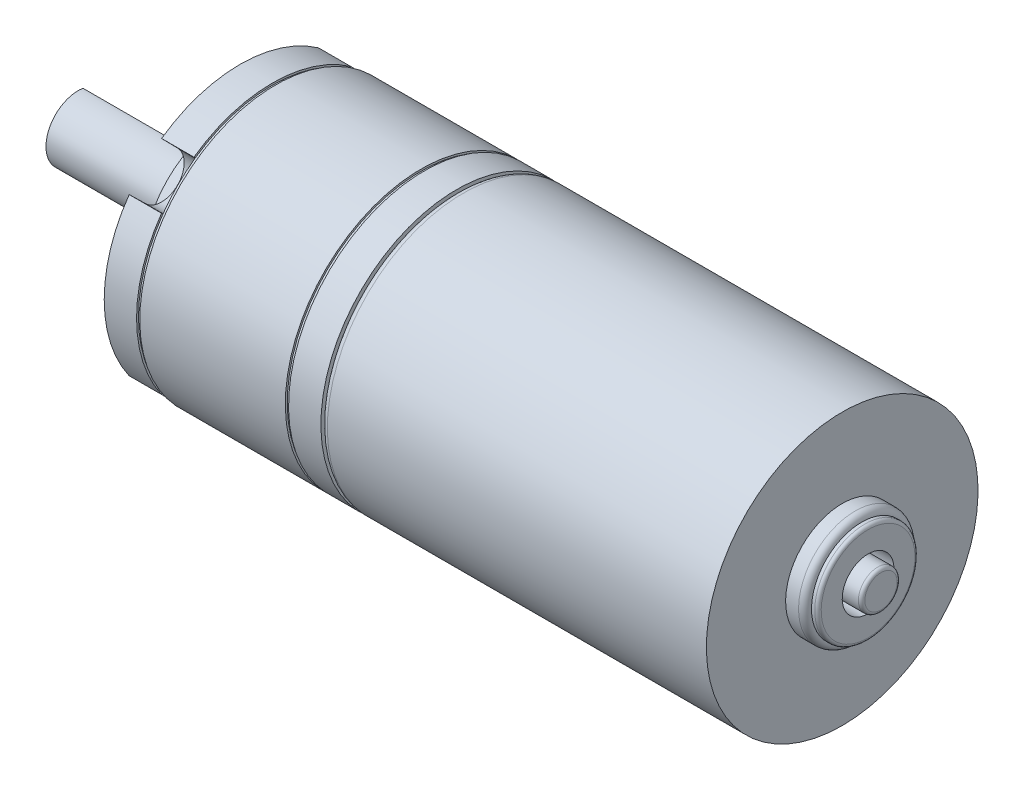
from build123d import *

# Parameters (mm, degrees)
SKETCH1_W               = 0.5
SKETCH1_H               = 20.7
SKETCH1_W_2             = 23
SKETCH1_H_2             = 5
SKETCH2_R               = 2.1
CUT_EXTRUDE1_DEPTH      = 10
CUT_EXTRUDE2_DEPTH      = 16
CUT_EXTRUDE3_DEPTH      = 5
SKETCH14_R              = 2.25
CUT_EXTRUDE4_DEPTH      = 10
ENL_V_START             = -4
ESQUISSE4_R             = 4
ESQUISSE4_R_2           = 3
ENL_V_MAT_EXTRU_1_DEPTH = 4


with BuildPart() as part:
    # Sketch1 → Revolve3 (revolve)
    with BuildSketch(Plane.XY, mode=Mode.PRIVATE) as revolve3_sk:
        with BuildLine():
            Line((0, 20), (0, 0))
            Line((0, 0), (59.6, 0))
            Line((59.6, 0), (59.6, 8.75))
            Line((59.6, 8.75), (59.6, 21))
            Line((59.6, 21), (1, 21))
            ThreePointArc((1, 21), (0.292893219, 20.707106781), (0, 20))
        make_face()
        Polygon((-5, 0), (0, 0), (0, 20), (0, 21), (-5, 21), (-5, 20.7), align=None)
        with BuildLine():
            Line((59.6, 8.75), (59.6, 0))
            Line((59.6, 0), (62.6, 0))
            Line((62.6, 0), (62.6, 7.75))
            ThreePointArc((62.6, 7.75), (62.307106781, 8.457106781), (61.6, 8.75))
            Line((61.6, 8.75), (59.6, 8.75))
        make_face()
        with Locations((-5.25, 10.35)):
            Rectangle(SKETCH1_W, SKETCH1_H)
        with BuildLine():
            Line((62.6, 7.75), (62.6, 0))
            Line((62.6, 0), (63.6, 0))
            Line((63.6, 0), (63.6, 3))
            Line((63.6, 3), (63.6, 7.25))
            ThreePointArc((63.6, 7.25), (63.453553391, 7.603553391), (63.1, 7.75))
            Line((63.1, 7.75), (62.6, 7.75))
        make_face()
        Polygon((-28, 0), (-5.5, 0), (-5.5, 20.7), (-5.5, 21), (-28, 21), (-28, 20.7), align=None)
        with BuildLine():
            Line((63.6, 3), (63.6, 0))
            Line((63.6, 0), (65.6, 0))
            Line((65.6, 0), (65.6, 2.5))
            ThreePointArc((65.6, 2.5), (65.453553391, 2.853553391), (65.1, 3))
            Line((65.1, 3), (63.6, 3))
        make_face()
        with Locations((-28.25, 10.35)):
            Rectangle(SKETCH1_W, SKETCH1_H)
        Polygon((-33.5, 0), (-28.5, 0), (-28.5, 20.7), (-28.5, 21), (-33.5, 21), (-33.5, 13), align=None)
        Polygon((-35.5, 0), (-33.5, 0), (-33.5, 13), (-35.5, 13), (-35.5, 5), align=None)
        with Locations((-47, 2.5)):
            Rectangle(SKETCH1_W_2, SKETCH1_H_2)
    revolve(revolve3_sk.sketch.rotate(Axis((-106.294937031, 0, 0), (1, 0, 0)), 180), axis=Axis((-106.294937031, 0, 0), (1, 0, 0)))

    # Sketch2 → Cut-Extrude1 (cut)
    with BuildSketch(Plane.ZY.offset(33.5)):
        with Locations(Location((0, 17.5, 0), (0, 0, 270))):
            Circle(SKETCH2_R)
        with Locations(Location((17.5, 0, 0), (0, 0, 270))):
            Circle(SKETCH2_R)
        with Locations(Location((0, -17.5, 0), (0, 0, 270))):
            Circle(SKETCH2_R)
        with Locations(Location((-17.5, 0, 0), (0, 0, 270))):
            Circle(SKETCH2_R)
    extrude(amount=-CUT_EXTRUDE1_DEPTH, mode=Mode.SUBTRACT)

    # Sketch5 → Cut-Extrude2 (cut)
    with BuildSketch(Plane.ZY.offset(58.5)):
        Polygon((-4.949747468, 0.707106781), (-0.707106781, 4.949747468), (-1.414213562, 5.656854249), (-5.656854249, 1.414213562), align=None)
    extrude(amount=-CUT_EXTRUDE2_DEPTH, mode=Mode.SUBTRACT)

    # Sketch12 → Cut-Extrude3 (cut)
    with BuildSketch(Plane.ZY.offset(33.5)):
        with BuildLine():
            Line((9.629672349, 14.579093037), (12.132820594, 17.140439447))
            ThreePointArc((12.132820594, 17.140439447), (14.849242405, 14.849242405), (17.140439447, 12.132820594))
            Line((17.140439447, 12.132820594), (14.579093037, 9.629672349))
            ThreePointArc((14.579093037, 9.629672349), (9.65794686, 9.65794686), (9.629672349, 14.579093037))
        make_face()
        with BuildLine():
            Line((14.579093037, -9.629672349), (17.140439447, -12.132820594))
            ThreePointArc((17.140439447, -12.132820594), (14.849242405, -14.849242405), (12.132820594, -17.140439447))
            Line((12.132820594, -17.140439447), (9.629672349, -14.579093037))
            ThreePointArc((9.629672349, -14.579093037), (9.65794686, -9.65794686), (14.579093037, -9.629672349))
        make_face()
        with BuildLine():
            Line((-9.629672349, -14.579093037), (-12.132820594, -17.140439447))
            ThreePointArc((-12.132820594, -17.140439447), (-14.849242405, -14.849242405), (-17.140439447, -12.132820594))
            Line((-17.140439447, -12.132820594), (-14.579093037, -9.629672349))
            ThreePointArc((-14.579093037, -9.629672349), (-9.65794686, -9.65794686), (-9.629672349, -14.579093037))
        make_face()
        with BuildLine():
            Line((-14.579093037, 9.629672349), (-17.140439447, 12.132820594))
            ThreePointArc((-17.140439447, 12.132820594), (-14.849242405, 14.849242405), (-12.132820594, 17.140439447))
            Line((-12.132820594, 17.140439447), (-9.629672349, 14.579093037))
            ThreePointArc((-9.629672349, 14.579093037), (-9.65794686, 9.65794686), (-14.579093037, 9.629672349))
        make_face()
    extrude(amount=-CUT_EXTRUDE3_DEPTH, mode=Mode.SUBTRACT)

    # Sketch14 → Cut-Extrude4 (cut)
    with BuildSketch(Plane.ZY.offset(28.5)):
        with Locations(Location((12.132820594, 12.132820594, 0), (0, 0, 270))):
            Circle(SKETCH14_R)
        with Locations(Location((12.132820594, -12.132820594, 0), (0, 0, 270))):
            Circle(SKETCH14_R)
        with Locations(Location((-12.132820594, -12.132820594, 0), (0, 0, 270))):
            Circle(SKETCH14_R)
        with Locations(Location((-12.132820594, 12.132820594, 0), (0, 0, 270))):
            Circle(SKETCH14_R)
    extrude(amount=-CUT_EXTRUDE4_DEPTH, mode=Mode.SUBTRACT)

    # Esquisse4 → Enlèv. mat.-Extru.1 (cut)
    with BuildSketch(Plane(origin=(63.6, 0, 0), x_dir=(0, 0, -1), z_dir=(1, 0, 0)).offset(ENL_V_START)):
        with Locations(Location((0, 0, 0), (0, 0, 90))):
            Circle(ESQUISSE4_R)
        with Locations(Location((0, 0, 0), (0, 0, 270))):
            Circle(ESQUISSE4_R_2, mode=Mode.SUBTRACT)
    extrude(amount=ENL_V_MAT_EXTRU_1_DEPTH, mode=Mode.SUBTRACT)


solid = part.part
